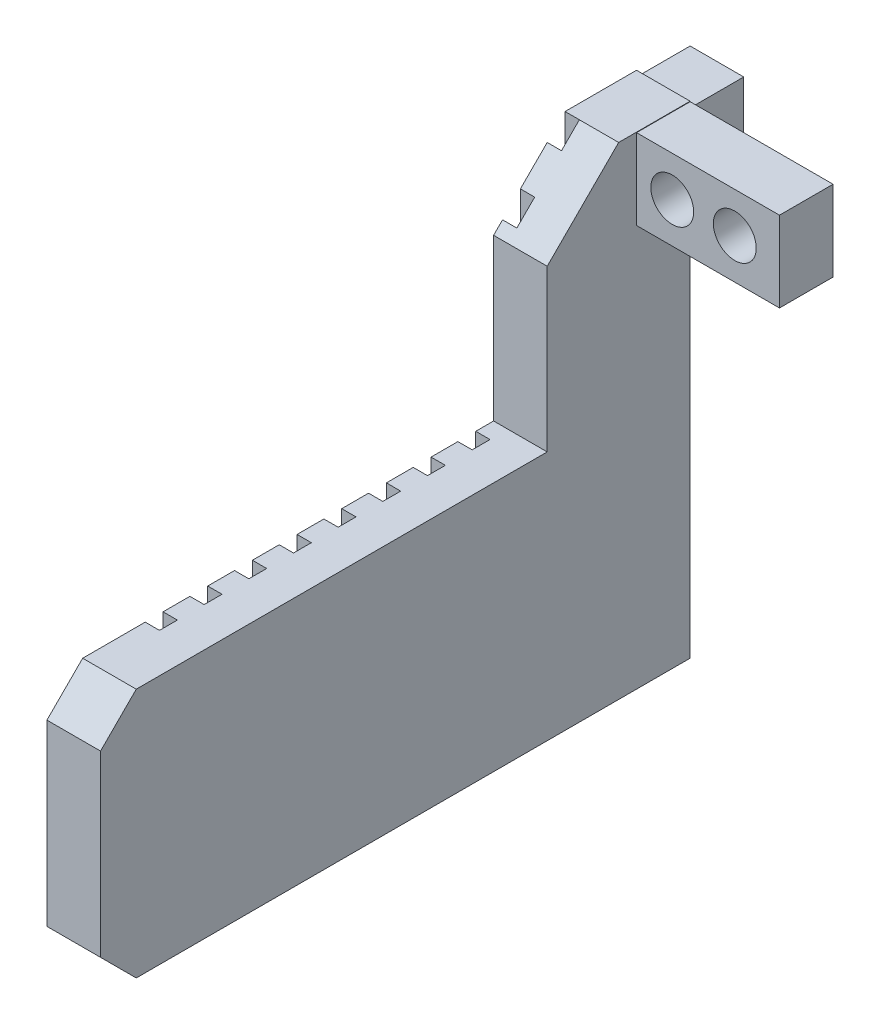
from build123d import *

# Parameters (mm, degrees)
BOSS_EXTRUDE1_START     = 25
SKETCH1_W               = 3
SKETCH1_H               = 27
BOSS_EXTRUDE1_DEPTH     = 8
BOSS_EXTRUDE2_START     = 32.5
SKETCH2_W               = 3
SKETCH2_H               = 14
BOSS_EXTRUDE2_DEPTH     = 25.5
BOSS_EXTRUDE3_START     = 25
SKETCH3_W               = 8
SKETCH3_H               = 4.5
BOSS_EXTRUDE3_DEPTH     = 3
BOSS_EXTRUDE4_START     = 22
SKETCH4_W               = 3
SKETCH4_H               = 3.9
BOSS_EXTRUDE4_DEPTH     = 3
CUT_EXTRUDE1_DEPTH      = 65.845971347
CUT_EXTRUDE1_DEPTH_BACK = 65.845971347
SKETCH5_R               = 1.2
CUT_EXTRUDE2_DEPTH      = 65.845971347
CUT_EXTRUDE2_DEPTH_BACK = 65.845971347
SKETCH6_W               = 1.8
SKETCH6_H               = 1
CUT_EXTRUDE3_DEPTH      = 65.845971347
CUT_EXTRUDE3_DEPTH_BACK = 65.845971347


with BuildPart() as part:
    # Sketch1 → Boss-Extrude1 (new body)
    with BuildSketch(Plane.XY.offset(BOSS_EXTRUDE1_START)):
        with Locations((11.5, 6.5)):
            Rectangle(SKETCH1_W, SKETCH1_H)
    extrude(amount=BOSS_EXTRUDE1_DEPTH)

    # Sketch2 → Boss-Extrude2 (add)
    with BuildSketch(Plane.XY.offset(BOSS_EXTRUDE2_START)):
        with Locations((11.5, 0)):
            Rectangle(SKETCH2_W, SKETCH2_H)
    extrude(amount=BOSS_EXTRUDE2_DEPTH)

    # Sketch3 → Boss-Extrude3 (add)
    with BuildSketch(Plane.XY.offset(BOSS_EXTRUDE3_START)):
        with Locations((17, 17.725)):
            Rectangle(SKETCH3_W, SKETCH3_H)
    extrude(amount=BOSS_EXTRUDE3_DEPTH)

    # Sketch4 → Boss-Extrude4 (add)
    with BuildSketch(Plane.XY.offset(BOSS_EXTRUDE4_START)):
        with Locations((11.5, 17.725)):
            Rectangle(SKETCH4_W, SKETCH4_H)
    extrude(amount=BOSS_EXTRUDE4_DEPTH)

    # Sketch5 → Cut-Extrude1 (cut, two sides: drawn at the far end of the back side and taken through both)
    with BuildSketch(Plane.XY.offset(-CUT_EXTRUDE1_DEPTH_BACK)):
        with Locations((15, 17.725)):
            Circle(SKETCH5_R)
        with Locations((18.5, 17.725)):
            Circle(SKETCH5_R)
    extrude(amount=CUT_EXTRUDE1_DEPTH + CUT_EXTRUDE1_DEPTH_BACK, mode=Mode.SUBTRACT)

    # Sketch6 → Cut-Extrude2 (cut, two sides: drawn at the far end of the back side and taken through both)
    with BuildSketch(Plane(origin=(0, 0, 0), x_dir=(1, 0, 0), z_dir=(0, 1, 0)).offset(-CUT_EXTRUDE2_DEPTH_BACK)):
        with Locations((9.9, -29.5)):
            Rectangle(SKETCH6_W, SKETCH6_H)
        with Locations((9.9, -32)):
            Rectangle(SKETCH6_W, SKETCH6_H)
        with Locations((9.9, -34.5)):
            Rectangle(SKETCH6_W, SKETCH6_H)
        with Locations((9.9, -37)):
            Rectangle(SKETCH6_W, SKETCH6_H)
        with Locations((9.9, -39.5)):
            Rectangle(SKETCH6_W, SKETCH6_H)
        with Locations((9.9, -42)):
            Rectangle(SKETCH6_W, SKETCH6_H)
        with Locations((9.9, -44.5)):
            Rectangle(SKETCH6_W, SKETCH6_H)
        with Locations((9.9, -47)):
            Rectangle(SKETCH6_W, SKETCH6_H)
        with Locations((9.9, -49.5)):
            Rectangle(SKETCH6_W, SKETCH6_H)
        with Locations((9.9, -52)):
            Rectangle(SKETCH6_W, SKETCH6_H)
    extrude(amount=CUT_EXTRUDE2_DEPTH + CUT_EXTRUDE2_DEPTH_BACK, mode=Mode.SUBTRACT)

    # Sketch7 → Cut-Extrude3 (cut, two sides: drawn at the far end of the back side and taken through both)
    with BuildSketch(Plane(origin=(0, 0, 0), x_dir=(0, 0, -1), z_dir=(1, 0, 0)).offset(-CUT_EXTRUDE3_DEPTH_BACK)):
        Polygon((-55.3, -7.7), (-59, -7.7), (-59, -4), align=None)
        Polygon((-55.3, 7.7), (-59, 4), (-59, 7.7), align=None)
        Polygon((-28, 21), (-34, 21), (-34, 15), align=None)
    extrude(amount=CUT_EXTRUDE3_DEPTH + CUT_EXTRUDE3_DEPTH_BACK, mode=Mode.SUBTRACT)


solid = part.part
